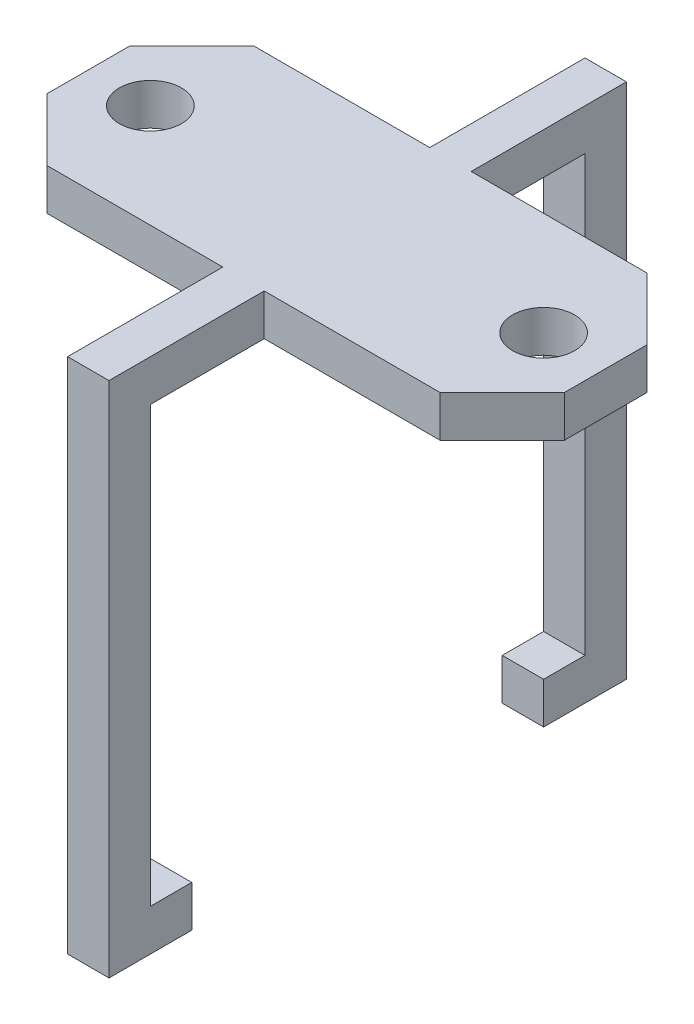
from build123d import *

# Parameters (mm, degrees)
SKETCH_1_W      = 25
SKETCH_1_H      = 10
SKETCH_1_R      = 1.5
EXTRUDE_1_DEPTH = 2
EXTRUDE_3_DEPTH = 1
CHAMFER_1_SIZE  = 3


with BuildPart() as part:
    # 스케치1 → 보스-돌출1 (new body)
    with BuildSketch(Plane(origin=(0, 0, 0), x_dir=(1, 0, 0), z_dir=(0, 1, 0))):
        Rectangle(SKETCH_1_W, SKETCH_1_H)
        with Locations(Location((-9.5, 0, 0), (0, 0, 270))):
            Circle(SKETCH_1_R, mode=Mode.SUBTRACT)
        with Locations(Location((9.5, 0, 0), (0, 0, 270))):
            Circle(SKETCH_1_R, mode=Mode.SUBTRACT)
    extrude(amount=EXTRUDE_1_DEPTH)

    # 스케치4 → 보스-돌출3 (add, symmetric)
    with BuildSketch(Plane(origin=(0, 0, 0), x_dir=(0, 0, -1), z_dir=(1, 0, 0))):
        Polygon((-10.5, 0), (-5, 0), (-5, 2), (-12.5, 2), (-12.5, -23), (-8.5, -23), (-8.5, -21), (-10.5, -21), align=None)
        Polygon((5, 2), (5, 0), (10.5, 0), (10.5, -21), (8.5, -21), (8.5, -23), (12.5, -23), (12.5, 2), align=None)
    extrude(amount=EXTRUDE_3_DEPTH, both=True)

    # 모따기1
    chamfer_1_edges = [part.edges().sort_by_distance(p)[0] for p in [
        (12.5, 1, -5),
        (12.5, 1, 5),
        (-12.5, 1, -5),
        (-12.5, 1, 5),
    ]]
    chamfer(chamfer_1_edges, length=CHAMFER_1_SIZE)


solid = part.part
